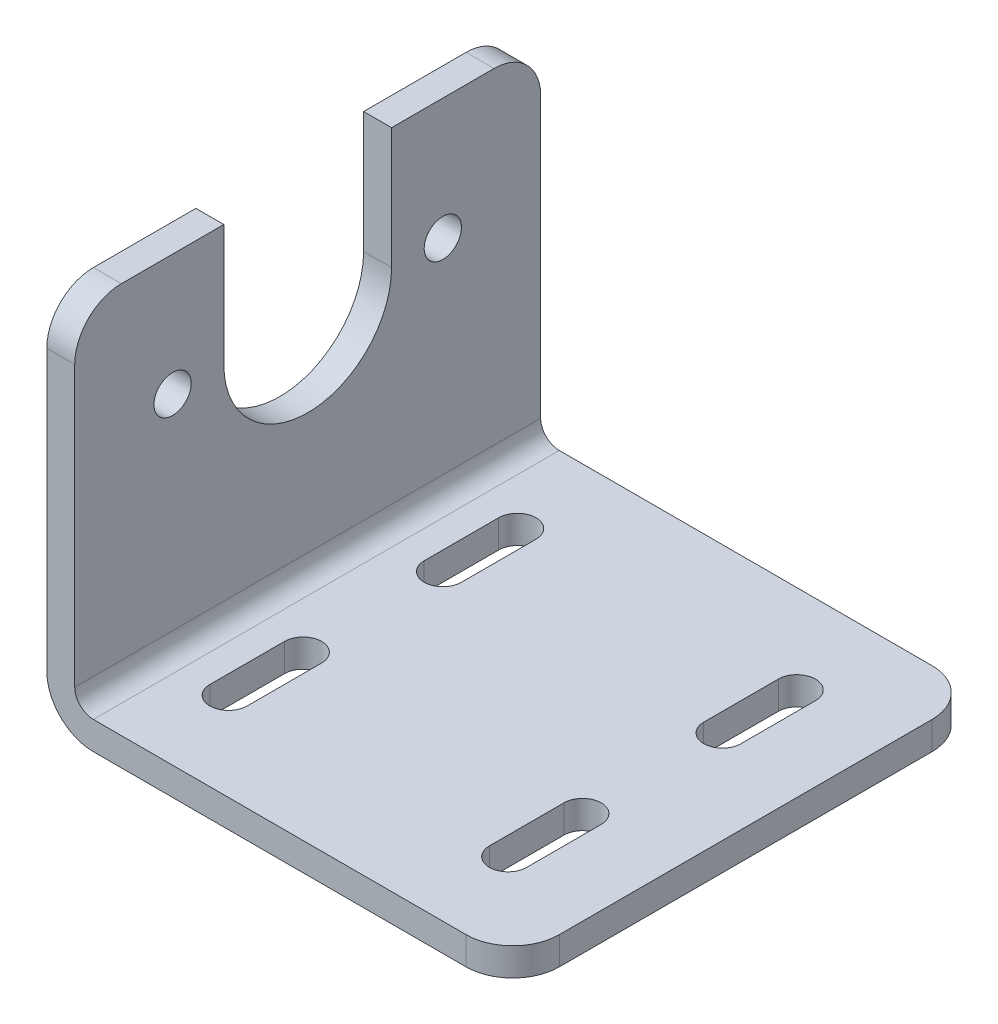
from build123d import *

# Parameters (mm, degrees)
EXTRUDE_1_DEPTH     = 50
SKETCH_2_R          = 2
CUT_EXTRUDE_1_DEPTH = 3
CUT_EXTRUDE_2_DEPTH = 3
FILLET_1_R          = 5
FILLET_2_R          = 5


with BuildPart() as part:
    # 草图1 → 凸台-拉伸1 (new body)
    with BuildSketch(Plane.XY):
        with BuildLine():
            Line((0, 19.792207792), (0, -15.207792208))
            ThreePointArc((0, -15.207792208), (0.585786438, -16.62200577), (2, -17.207792208))
            Line((2, -17.207792208), (47, -17.207792208))
            Line((47, -17.207792208), (47, -20.207792208))
            Line((47, -20.207792208), (-3, -20.207792208))
            Line((-3, -20.207792208), (-3, 19.792207792))
            Line((-3, 19.792207792), (0, 19.792207792))
        make_face()
    extrude(amount=EXTRUDE_1_DEPTH)

    # 草图2 → 切除-拉伸1 (cut)
    with BuildSketch(Plane.ZY.offset(3)):
        with Locations((10.5, 6.792207792)):
            Circle(SKETCH_2_R)
        with BuildLine():
            Line((34, 19.792207792), (16, 19.792207792))
            Line((16, 19.792207792), (16, 6.792207792))
            ThreePointArc((16, 6.792207792), (25, -2.207792208), (34, 6.792207792))
            Line((34, 6.792207792), (34, 19.792207792))
        make_face()
        with Locations((39.5, 6.792207792)):
            Circle(SKETCH_2_R)
    extrude(amount=-CUT_EXTRUDE_1_DEPTH, mode=Mode.SUBTRACT)

    # 草图3 → 切除-拉伸2 (cut)
    with BuildSketch(Plane.XZ.offset(20.207792208)):
        with BuildLine():
            Line((39, 32.5), (39, 40.5))
            ThreePointArc((39, 40.5), (37, 42.5), (35, 40.5))
            Line((35, 40.5), (35, 32.5))
            ThreePointArc((35, 32.5), (37, 30.5), (39, 32.5))
        make_face()
        with BuildLine():
            Line((35, 17.5), (35, 9.5))
            ThreePointArc((35, 9.5), (37, 7.5), (39, 9.5))
            Line((39, 9.5), (39, 17.5))
            ThreePointArc((39, 17.5), (37, 19.5), (35, 17.5))
        make_face()
        with BuildLine():
            Line((5, 17.5), (5, 9.5))
            ThreePointArc((5, 9.5), (7, 7.5), (9, 9.5))
            Line((9, 9.5), (9, 17.5))
            ThreePointArc((9, 17.5), (7, 19.5), (5, 17.5))
        make_face()
        with BuildLine():
            Line((9, 32.5), (9, 40.5))
            ThreePointArc((9, 40.5), (7, 42.5), (5, 40.5))
            Line((5, 40.5), (5, 32.5))
            ThreePointArc((5, 32.5), (7, 30.5), (9, 32.5))
        make_face()
    extrude(amount=-CUT_EXTRUDE_2_DEPTH, mode=Mode.SUBTRACT)

    # 圆角1
    fillet_1_edges = [part.edges().sort_by_distance(p)[0] for p in [
        (-3, -20.207792208, 25),
    ]]
    fillet(fillet_1_edges, radius=FILLET_1_R)

    # 圆角2
    fillet_2_edges = [part.edges().sort_by_distance(p)[0] for p in [
        (47, -18.707792208, 50),
        (-1.5, 19.792207792, 50),
        (47, -18.707792208, 0),
        (-1.5, 19.792207792, 0),
    ]]
    fillet(fillet_2_edges, radius=FILLET_2_R)


solid = part.part
